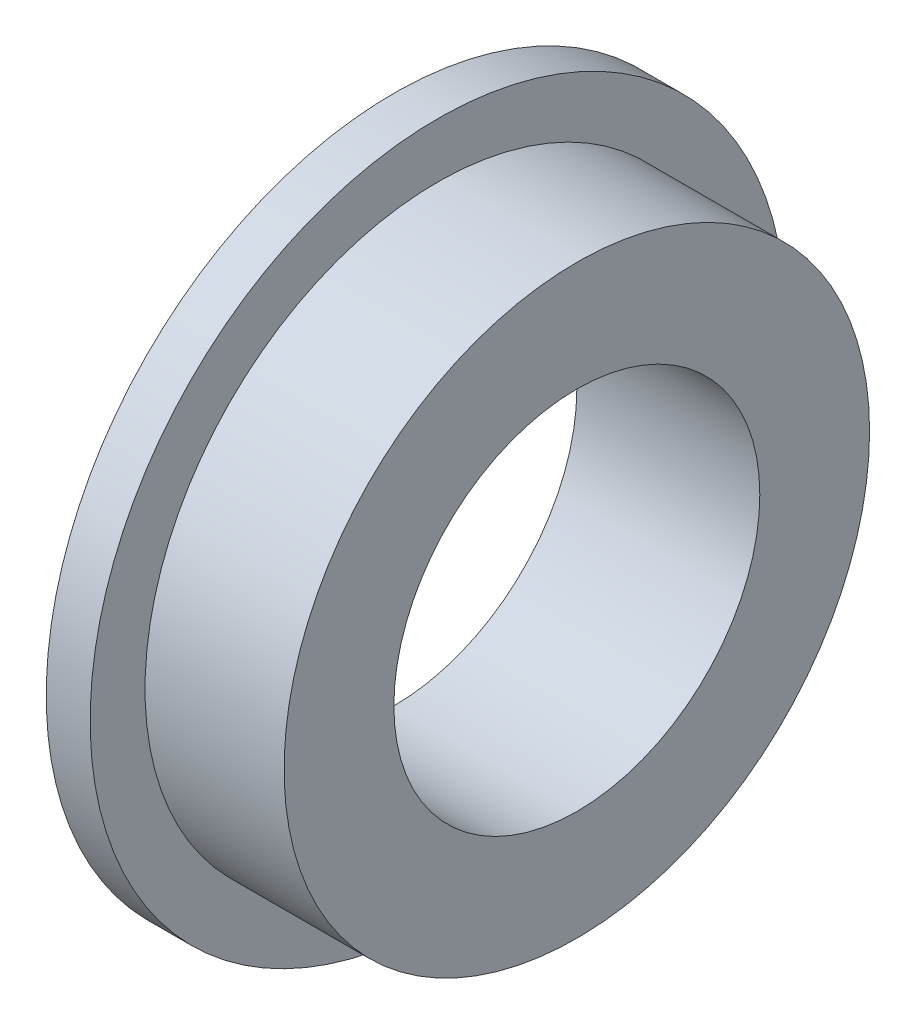
from build123d import *

# Parameters (mm, degrees)
SKETCH_1_R      = 4
SKETCH_1_R_2    = 2.5
EXTRUDE_1_DEPTH = 2.5
SKETCH_1_3_R    = 4.75
SKETCH_1_3_R_2  = 4
EXTRUDE_2_DEPTH = 0.6


with BuildPart() as part:
    # 草图1 → 凸台-拉伸1 (new body)
    with BuildSketch(Plane(origin=(0, 0, 0), x_dir=(0, 0, -1), z_dir=(1, 0, 0))):
        Circle(SKETCH_1_R)
        Circle(SKETCH_1_R_2, mode=Mode.SUBTRACT)
    extrude(amount=EXTRUDE_1_DEPTH)

    # 草图1<3> → 凸台-拉伸2 (add)
    with BuildSketch(Plane(origin=(0, 0, 0), x_dir=(0, 0, -1), z_dir=(1, 0, 0))):
        Circle(SKETCH_1_3_R)
        Circle(SKETCH_1_3_R_2, mode=Mode.SUBTRACT)
    extrude(amount=EXTRUDE_2_DEPTH)


solid = part.part
